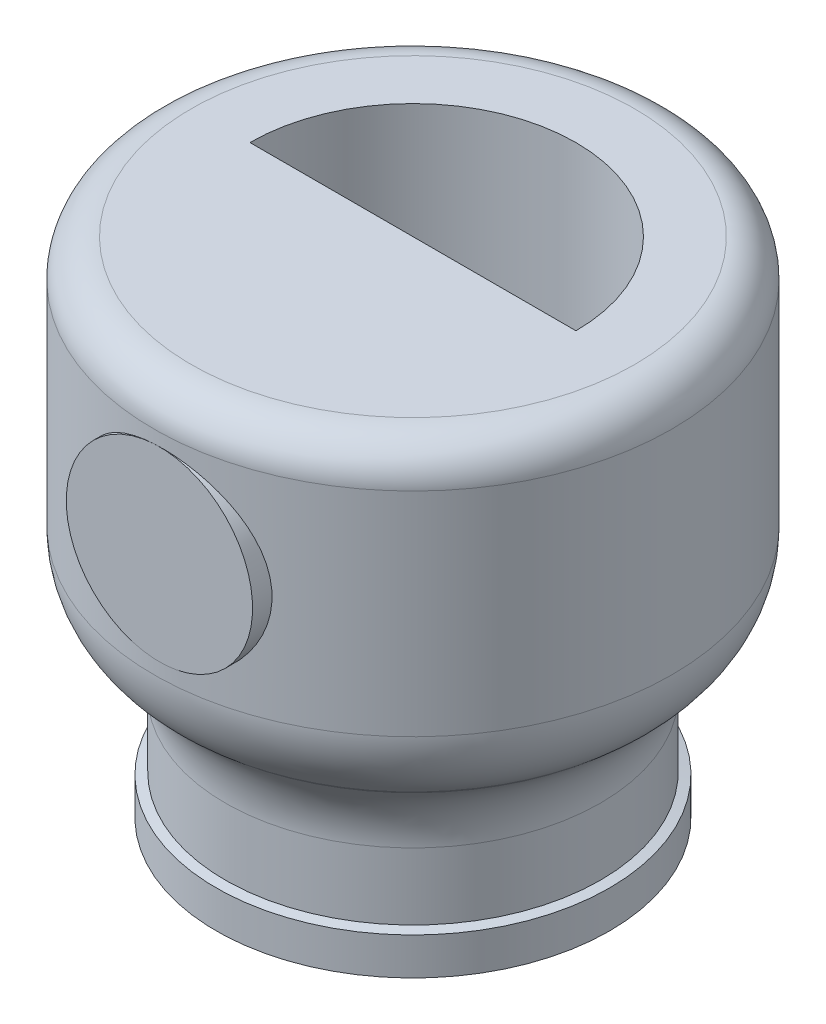
from build123d import *
from build123d.topology import SkipClean

# Parameters (mm, degrees)
SKETCH10_R              = 10
BOSS_EXTRUDE1_DEPTH     = 5
CUT_EXTRUDE3_DEPTH      = 45
CUT_EXTRUDE3_DEPTH_BACK = 20


with BuildPart() as part:
    # Sketch1 → Revolve1 (revolve)
    with BuildSketch(Plane.XY):
        with BuildLine():
            Line((20.9, 0), (23.871591838, 0))
            Line((23.871591838, 0), (23.871591838, 4))
            Line((23.871591838, 4), (22.9, 4.236662843))
            Line((22.9, 4.236662843), (22.9, 11.404308102))
            ThreePointArc((22.9, 11.404308102), (23.83692213, 15.63049072), (26.472123903, 19.064752533))
            Line((26.472123903, 19.064752533), (26.988320528, 19.497892931))
            ThreePointArc((26.988320528, 19.497892931), (29.623522302, 22.932154745), (30.560444431, 27.158337362))
            Line((30.560444431, 27.158337362), (30.560444431, 50))
            ThreePointArc((30.560444431, 50), (29.388871556, 52.828427125), (26.560444431, 54))
            Line((26.560444431, 54), (2.764914955, 54))
            Line((2.764914955, 54), (2.764914955, 15))
            Line((2.764914955, 15), (19.9, 15))
            ThreePointArc((19.9, 15), (20.607106781, 14.707106781), (20.9, 14))
            Line((20.9, 14), (20.9, 0))
        make_face()
    revolve(axis=Axis((2.764914955, 7.821821657, 0), (0, 1, 0)))

    # Sketch10 → Boss-Extrude1 (add)
    with SkipClean():  # the faces are left unmerged after this step: merging them gives an invalid solid
        with BuildSketch(Plane.XY.offset(27.795529476)):
            with Locations((3.346345887, 38.658337362)):
                Circle(SKETCH10_R)
        extrude(amount=-BOSS_EXTRUDE1_DEPTH)

    # Sketch11 → Cut-Extrude3 (cut, two sides: drawn at the far end of the back side and taken through both)
    with SkipClean():  # the faces are left unmerged after this step: merging them gives an invalid solid
        with BuildSketch(Plane(origin=(0, 17, 0), x_dir=(1, 0, 0), z_dir=(0, 1, 0)).offset(-CUT_EXTRUDE3_DEPTH_BACK)):
            with BuildLine():
                Line((-14.735085045, 0), (20.264914955, 0))
                ThreePointArc((20.264914955, 0), (2.764914955, 17.5), (-14.735085045, 0))
            make_face()
        extrude(amount=CUT_EXTRUDE3_DEPTH + CUT_EXTRUDE3_DEPTH_BACK, mode=Mode.SUBTRACT)


solid = part.part
